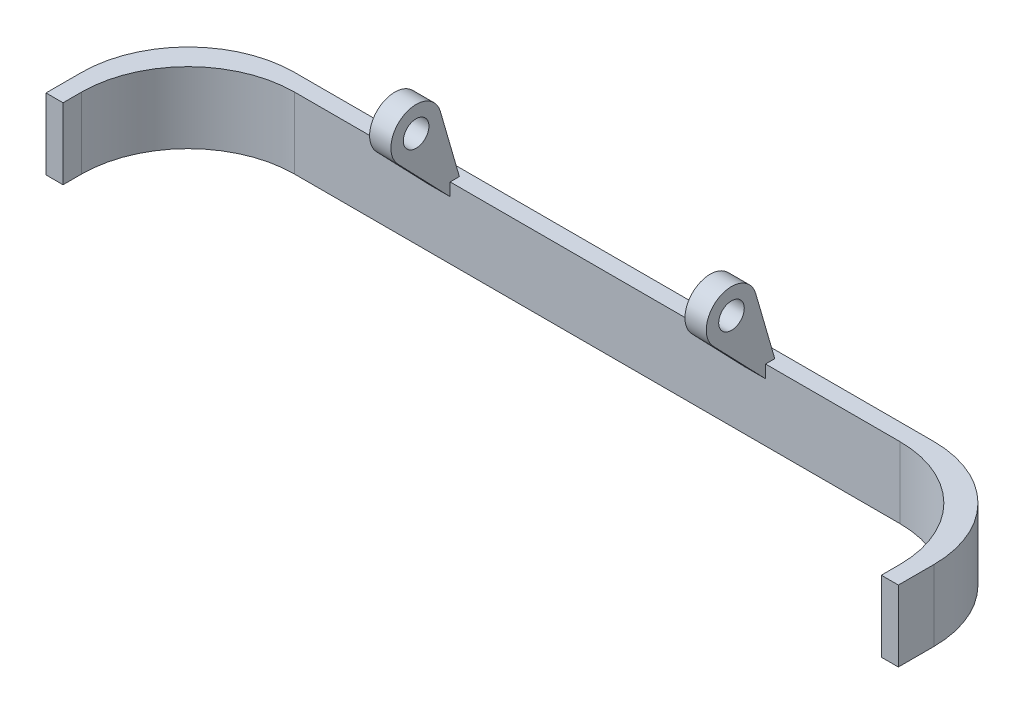
from build123d import *

# Parameters (mm, degrees)
BOSS_EXTRUDE1_DEPTH  = 10
SKETCH2_R            = 3.55
SKETCH2_R_2          = 1.75
BOSS_EXTRUDE2_DEPTH  = 3
BOSS_EXTRUDE3_START  = -44.4
SKETCH2_3_R          = 3.55
SKETCH2_3_R_2        = 1.75
BOSS_EXTRUDE3_DEPTH  = 3
M3_CLEARANCE_HOLE1_D = 3.6


with BuildPart() as part:
    # Sketch1 → Boss-Extrude1 (new body)
    with BuildSketch(Plane(origin=(0, 0, 0), x_dir=(1, 0, 0), z_dir=(0, 1, 0))):
        with BuildLine():
            Line((0, 0), (0, 5))
            ThreePointArc((0, 5), (4.393398282, 15.606601718), (15, 20))
            Line((15, 20), (105, 20))
            ThreePointArc((105, 20), (115.606601718, 15.606601718), (120, 5))
            Line((120, 5), (120, 0))
            Line((120, 0), (117.6, 0))
            Line((117.6, 0), (117.6, 2.6))
            ThreePointArc((117.6, 2.6), (113.206601718, 13.206601718), (102.6, 17.6))
            Line((102.6, 17.6), (17.4, 17.6))
            ThreePointArc((17.4, 17.6), (6.793398282, 13.206601718), (2.4, 2.6))
            Line((2.4, 2.6), (2.4, 0))
            Line((2.4, 0), (0, 0))
        make_face()
    extrude(amount=BOSS_EXTRUDE1_DEPTH)

    # Sketch2 → Boss-Extrude2 (add)
    # profile 1 of 3: a face of its own
    with BuildSketch(Plane(origin=(80.7, 0, 0), x_dir=(0, 0, -1), z_dir=(1, 0, 0))):
        with BuildLine():
            Line((17.6, 10), (18.9, 10))
            Line((18.9, 10), (16.218619991, 19.284947678))
            ThreePointArc((16.218619991, 19.284947678), (16.32297688, 18.797379809), (16.357992766, 18.3))
            ThreePointArc((16.357992766, 18.3), (14.134741273, 15.007244558), (10.249689442, 15.838784019))
            Line((10.249689442, 15.838784019), (17.6, 8.19852649))
            Line((17.6, 8.19852649), (17.6, 10))
        make_face()
    # profile 2 of 3: a face of its own
    with BuildSketch(Plane(origin=(80.7, 0, 0), x_dir=(0, 0, -1), z_dir=(1, 0, 0))):
        with Locations((12.807992766, 18.3)):
            Circle(SKETCH2_R)
        with Locations((12.807992766, 18.3)):
            Circle(SKETCH2_R_2, mode=Mode.SUBTRACT)
    # profile 3 of 3: a face of its own
    with BuildSketch(Plane(origin=(80.7, 0, 0), x_dir=(0, 0, -1), z_dir=(1, 0, 0))):
        with Locations((12.807992766, 18.3)):
            Circle(SKETCH2_R_2)
    extrude(amount=BOSS_EXTRUDE2_DEPTH)

    # Sketch2<3> → Boss-Extrude3 (add)
    with BuildSketch(Plane(origin=(80.7, 0, 0), x_dir=(0, 0, -1), z_dir=(1, 0, 0)).offset(BOSS_EXTRUDE3_START)):
        with BuildLine():
            Line((17.6, 10), (18.9, 10))
            Line((18.9, 10), (16.218619991, 19.284947678))
            ThreePointArc((16.218619991, 19.284947678), (16.32297688, 18.797379809), (16.357992766, 18.3))
            ThreePointArc((16.357992766, 18.3), (14.134741273, 15.007244558), (10.249689442, 15.838784019))
            Line((10.249689442, 15.838784019), (17.6, 8.19852649))
            Line((17.6, 8.19852649), (17.6, 10))
        make_face()
        with Locations((12.807992766, 18.3)):
            Circle(SKETCH2_3_R)
        with Locations((12.807992766, 18.3)):
            Circle(SKETCH2_3_R_2)
    extrude(amount=BOSS_EXTRUDE3_DEPTH)

    # M3 Clearance Hole1 (through all)
    with Locations(Plane(origin=(83.7, 0, 0), x_dir=(0, 0, -1), z_dir=(1, 0, 0))):
        with Locations((12.807992766, 18.3)):
            Hole(M3_CLEARANCE_HOLE1_D / 2)


solid = part.part
